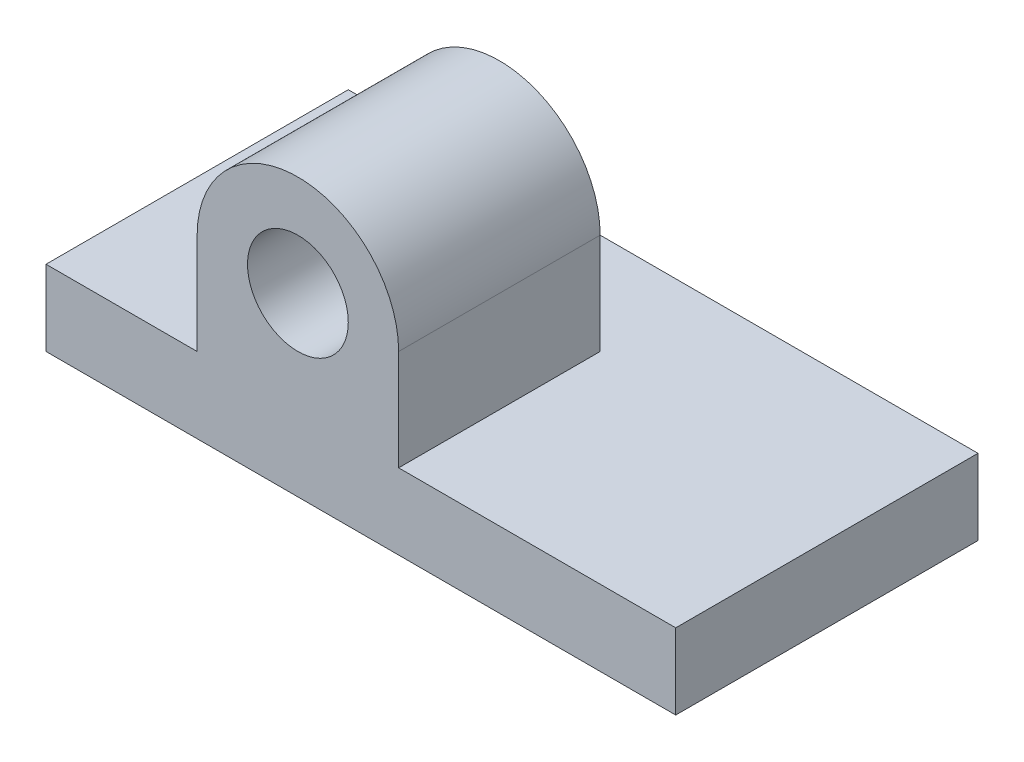
from build123d import *

# Parameters (mm, degrees)
SZKIC2_R                    = 10
DODANIE_WYCI_GNI_CIE1_DEPTH = 60
WYTNIJ_WYCI_GNI_CIE1_START  = -20
SZKIC3_R                    = 10
WYTNIJ_WYCI_GNI_CIE1_DEPTH  = 20


with BuildPart() as part:
    # Szkic2 → Dodanie-wyciągnięcie1 (new body)
    with BuildSketch(Plane.XY):
        with BuildLine():
            Line((0, 0), (125, 0))
            Line((125, 0), (125, 15))
            Line((125, 15), (70, 15))
            Line((70, 15), (70, 35))
            ThreePointArc((70, 35), (50, 55), (30, 35))
            Line((30, 35), (30, 15))
            Line((30, 15), (0, 15))
            Line((0, 15), (0, 0))
        make_face()
        with Locations((50, 35)):
            Circle(SZKIC2_R, mode=Mode.SUBTRACT)
    extrude(amount=-DODANIE_WYCI_GNI_CIE1_DEPTH)

    # Szkic3 → Wytnij-wyciągnięcie1 (cut)
    with BuildSketch(Plane(origin=(0, 0, -60), x_dir=(-1, 0, 0), z_dir=(0, 0, -1)).offset(WYTNIJ_WYCI_GNI_CIE1_START)):
        with BuildLine():
            Line((-70, 15), (-30, 15))
            Line((-30, 15), (-30, 35))
            ThreePointArc((-30, 35), (-50, 55), (-70, 35))
            Line((-70, 35), (-70, 15))
        make_face()
        with Locations(Location((-50, 35, 0), (0, 0, 180))):
            Circle(SZKIC3_R, mode=Mode.SUBTRACT)
    extrude(amount=WYTNIJ_WYCI_GNI_CIE1_DEPTH, mode=Mode.SUBTRACT)


solid = part.part
